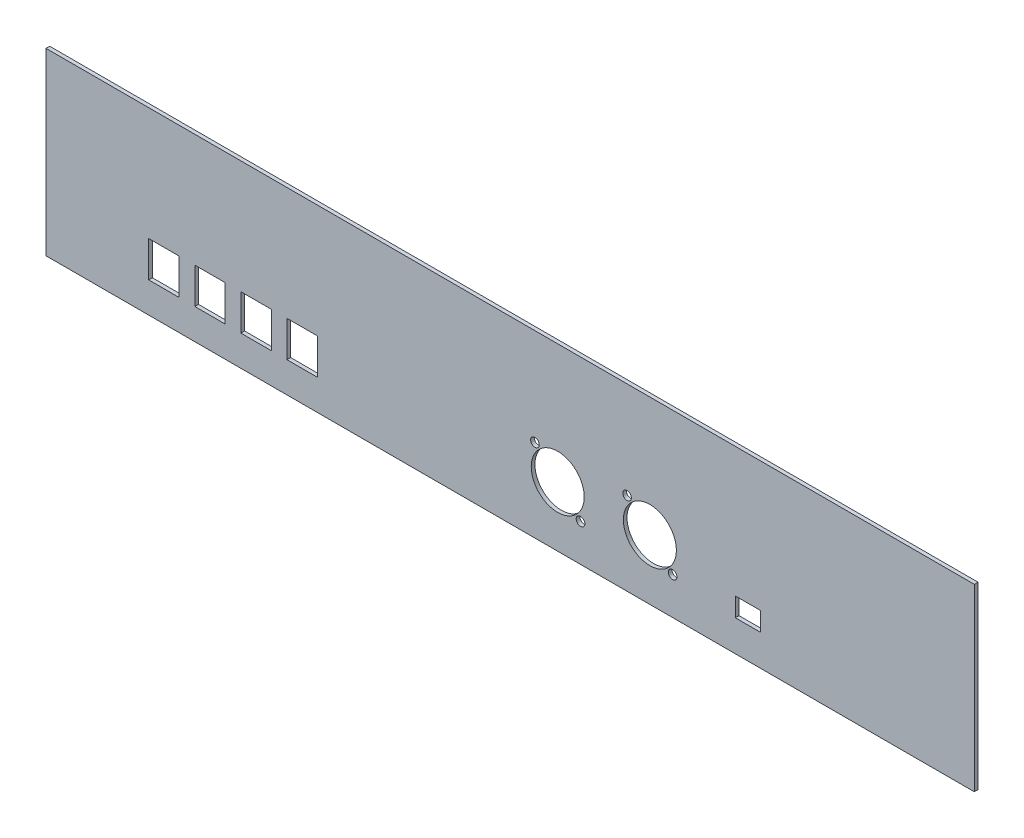
from build123d import *

# Parameters (mm, degrees)
PANEL_W             = 403
PANEL_H             = 78
BOSS_EXTRUDE1_DEPTH = 1.6
XLR4_R              = 11.5
XLR4_R_2            = 1.875
CUT_EXTRUDE2_DEPTH  = 1.6
RJ11_W              = 13.2
RJ11_H              = 15.55
CUT_EXTRUDE3_DEPTH  = 1.6
DC_PORT_W           = 10.85
DC_PORT_H           = 8.2
CUT_EXTRUDE4_DEPTH  = 1.6


with BuildPart() as part:
    # Panel → Boss-Extrude1 (new body)
    with BuildSketch(Plane.XY):
        with Locations((201.5, 39)):
            Rectangle(PANEL_W, PANEL_H)
    extrude(amount=BOSS_EXTRUDE1_DEPTH)

    # XLR4 → Cut-Extrude2 (cut)
    with BuildSketch(Plane.XY):
        with Locations(Location((222.15, 26.1, 0), (0, 0, 180))):
            Circle(XLR4_R)
        with Locations(Location((212.25, 36, 0), (0, 0, 180))):
            Circle(XLR4_R_2)
        with Locations(Location((232.05, 16.2, 0), (0, 0, 180))):
            Circle(XLR4_R_2)
        with Locations(Location((262.15, 26.1, 0), (0, 0, 180))):
            Circle(XLR4_R)
        with Locations(Location((252.25, 36, 0), (0, 0, 180))):
            Circle(XLR4_R_2)
        with Locations(Location((272.05, 16.2, 0), (0, 0, 180))):
            Circle(XLR4_R_2)
    extrude(amount=CUT_EXTRUDE2_DEPTH, mode=Mode.SUBTRACT)

    # RJ11 → Cut-Extrude3 (cut)
    with BuildSketch(Plane.XY):
        with Locations((71.2, 21.025)):
            Rectangle(RJ11_W, RJ11_H)
        with Locations((51.2, 21.025)):
            Rectangle(RJ11_W, RJ11_H)
        with Locations((91.2, 21.025)):
            Rectangle(RJ11_W, RJ11_H)
        with Locations((111.2, 21.025)):
            Rectangle(RJ11_W, RJ11_H)
    extrude(amount=CUT_EXTRUDE3_DEPTH, mode=Mode.SUBTRACT)

    # DC PORT → Cut-Extrude4 (cut)
    with BuildSketch(Plane.XY):
        with Locations((304.675, 17.65)):
            Rectangle(DC_PORT_W, DC_PORT_H)
    extrude(amount=CUT_EXTRUDE4_DEPTH, mode=Mode.SUBTRACT)


solid = part.part
